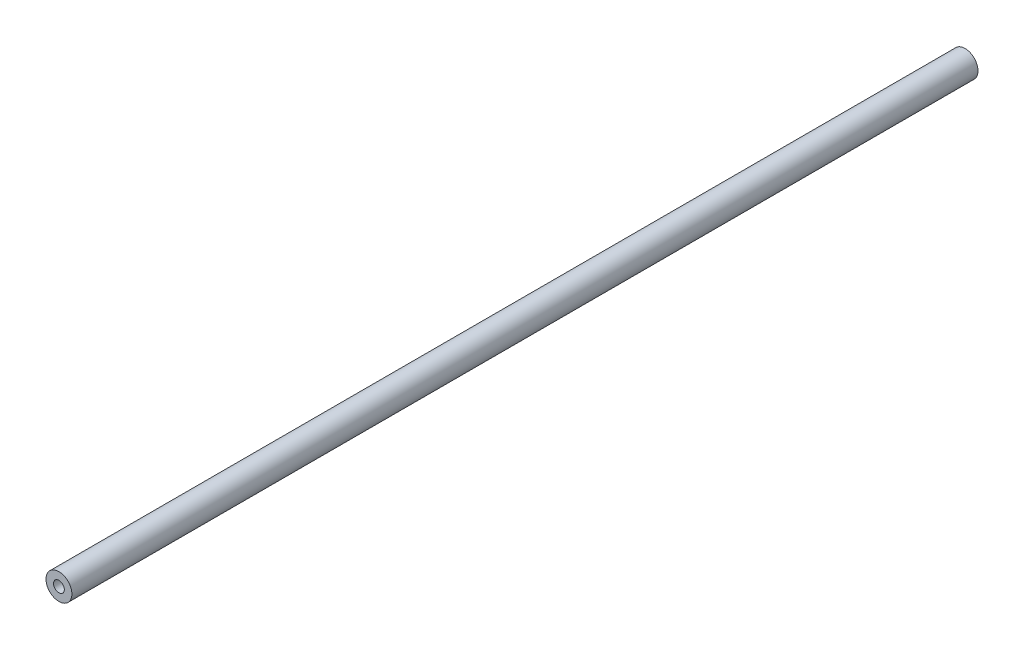
from build123d import *

# Parameters (mm, degrees)
SKETCH_1_R          = 6
SKETCH_1_R_2        = 0.0005
EXTRUDE_1_DEPTH     = 420
SKETCH_2_R          = 2.5
CUT_EXTRUDE_1_DEPTH = 421.085705541


with BuildPart() as part:
    # 草图1 → 凸台-拉伸1 (new body)
    with BuildSketch(Plane.XY):
        Circle(SKETCH_1_R)
        Circle(SKETCH_1_R_2, mode=Mode.SUBTRACT)
    extrude(amount=-EXTRUDE_1_DEPTH)

    # 草图2 → 切除-拉伸1 (cut, through all)
    with BuildSketch(Plane.XY):
        Circle(SKETCH_2_R)
    extrude(amount=-CUT_EXTRUDE_1_DEPTH, mode=Mode.SUBTRACT)


solid = part.part
